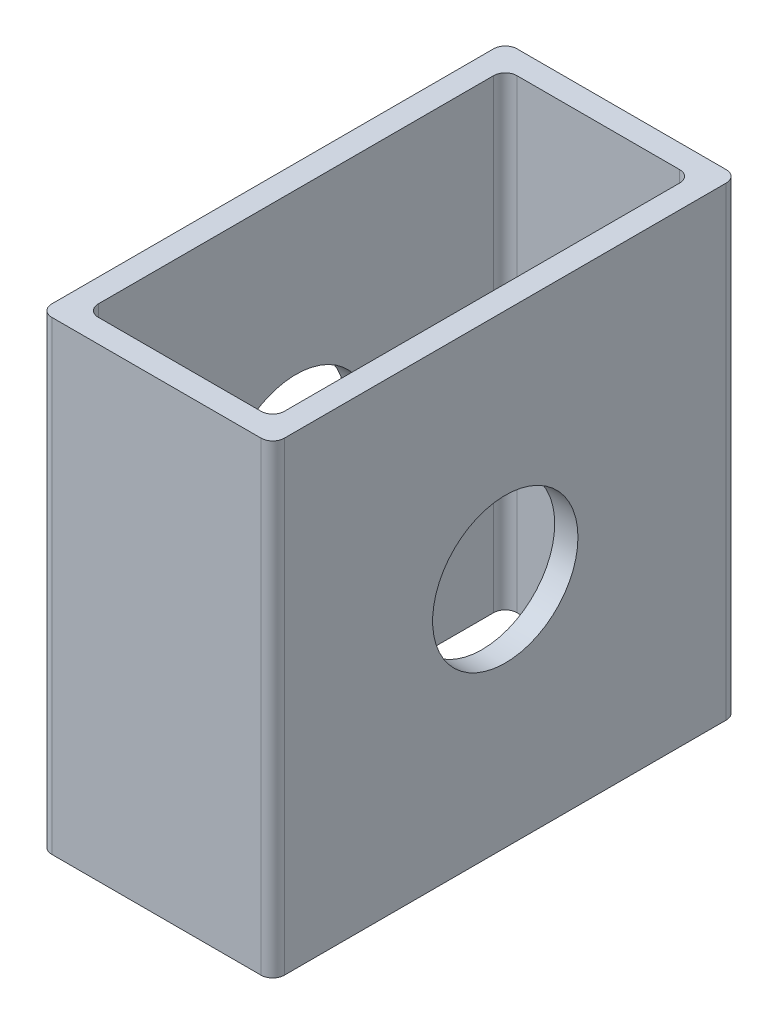
from build123d import *

# Parameters (mm, degrees)
BOSS_EXTRU_1_DEPTH      = 705
ESQUISSE3_R             = 10.125
ESQUISSE3_R_2           = 12.5
ENL_V_MAT_EXTRU_1_DEPTH = 711.651109899
ESQUISSE4_W             = 618.270478043
ESQUISSE4_H             = 899.840554594
ESQUISSE4_W_2           = 40
ESQUISSE4_H_2           = 80
ENL_V_MAT_EXTRU_2_DEPTH = 711.651109899


with BuildPart() as part:
    # Esquisse2 → Boss.-Extru.1 (new body)
    with BuildSketch(Plane(origin=(0, 0, 0), x_dir=(1, 0, 0), z_dir=(0, 1, 0))):
        with BuildLine():
            Line((2, 0), (38, 0))
            ThreePointArc((38, 0), (39.414213562, 0.585786438), (40, 2))
            Line((40, 2), (40, 78))
            ThreePointArc((40, 78), (39.414213562, 79.414213562), (38, 80))
            Line((38, 80), (2, 80))
            ThreePointArc((2, 80), (0.585786438, 79.414213562), (0, 78))
            Line((0, 78), (0, 2))
            ThreePointArc((0, 2), (0.585786438, 0.585786438), (2, 0))
        make_face()
        with BuildLine():
            Line((6, 4), (34, 4))
            ThreePointArc((34, 4), (35.414213562, 4.585786438), (36, 6))
            Line((36, 6), (36, 74))
            ThreePointArc((36, 74), (35.414213562, 75.414213562), (34, 76))
            Line((34, 76), (6, 76))
            ThreePointArc((6, 76), (4.585786438, 75.414213562), (4, 74))
            Line((4, 74), (4, 6))
            ThreePointArc((4, 6), (4.585786438, 4.585786438), (6, 4))
        make_face(mode=Mode.SUBTRACT)
    extrude(amount=BOSS_EXTRU_1_DEPTH)

    # Esquisse3 → Enlèv. mat.-Extru.1 (cut, through all)
    with BuildSketch(Plane(origin=(40, 0, 0), x_dir=(0, 0, -1), z_dir=(1, 0, 0))):
        with Locations((40, 90)):
            Circle(ESQUISSE3_R)
        with Locations((40, 665)):
            Circle(ESQUISSE3_R_2)
    extrude(amount=-ENL_V_MAT_EXTRU_1_DEPTH, mode=Mode.SUBTRACT)

    # Esquisse4 → Enlèv. mat.-Extru.2 (cut, through all)
    with BuildSketch(Plane.XY):
        with Locations((15.340579257, 415.457209906)):
            Rectangle(ESQUISSE4_W, ESQUISSE4_H)
        with Locations((20, 665)):
            Rectangle(ESQUISSE4_W_2, ESQUISSE4_H_2, mode=Mode.SUBTRACT)
    extrude(amount=-ENL_V_MAT_EXTRU_2_DEPTH, mode=Mode.SUBTRACT)


solid = part.part
